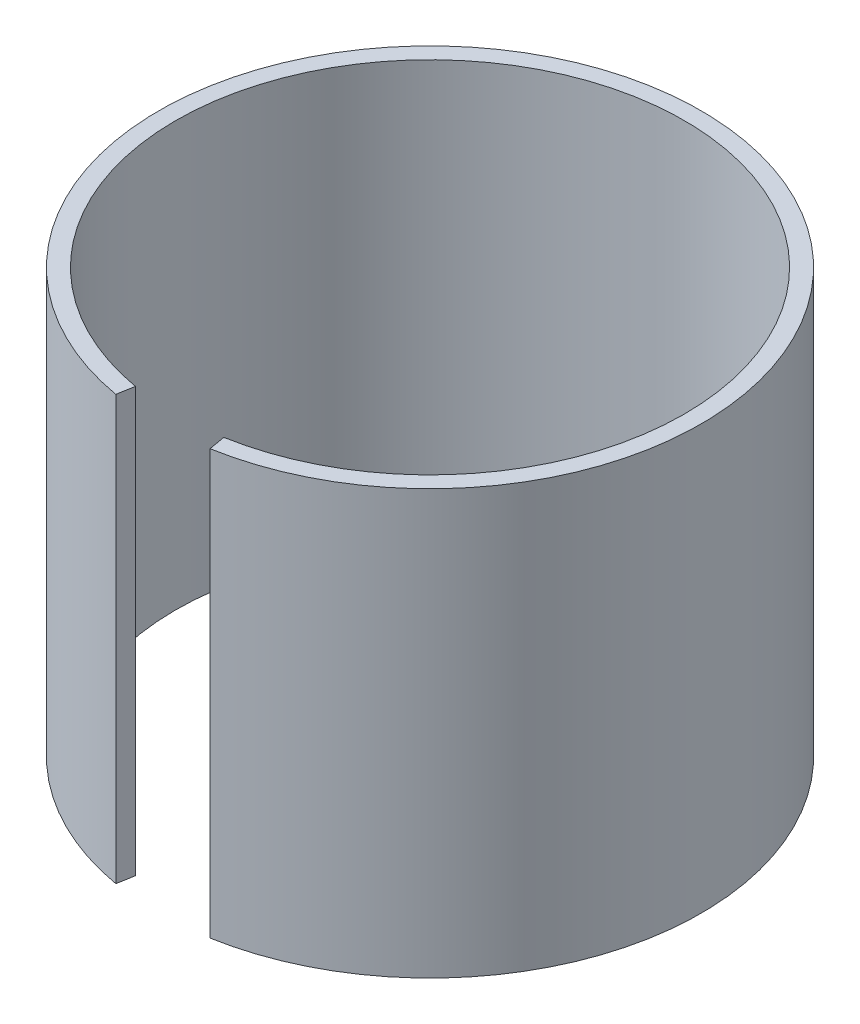
from build123d import *

# Parameters (mm, degrees)
EXTRUDE1_DEPTH = 50


with BuildPart() as part:
    # Sketch1 → Extrude1 (new body)
    with BuildSketch(Plane(origin=(0, 0, 0), x_dir=(1, 0, 0), z_dir=(0, 1, 0))):
        with BuildLine():
            Line((5.20944533, -29.54423259), (5.556741685, -31.513848096))
            ThreePointArc((5.556741685, -31.513848096), (0, 32), (-5.556741685, -31.513848096))
            Line((-5.556741685, -31.513848096), (-5.20944533, -29.54423259))
            ThreePointArc((-5.20944533, -29.54423259), (0, 30), (5.20944533, -29.54423259))
        make_face()
    extrude(amount=EXTRUDE1_DEPTH)


solid = part.part
